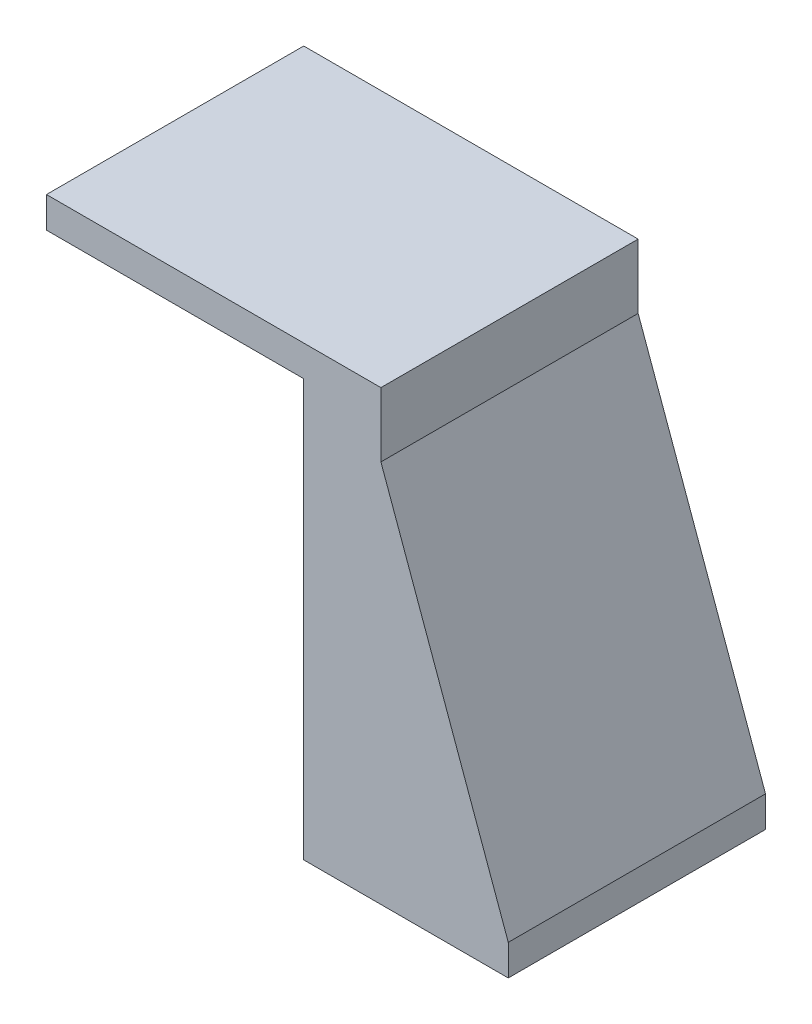
from build123d import *

# Parameters (mm, degrees)
BOSS_EXTRUDE1_DEPTH = 50


with BuildPart() as part:
    # Sketch1 → Boss-Extrude1 (new body)
    with BuildSketch(Plane.XY):
        Polygon((25.244480702, 2.312557033), (65, 2.312557033), (65, 8.312557033), (40.244480702, 76.803573807), (40.244480702, 89.312557033), (-24.755519298, 89.312557033), (-24.755519298, 83.312557033), (25.244480702, 83.312557033), align=None)
    extrude(amount=BOSS_EXTRUDE1_DEPTH)


solid = part.part
